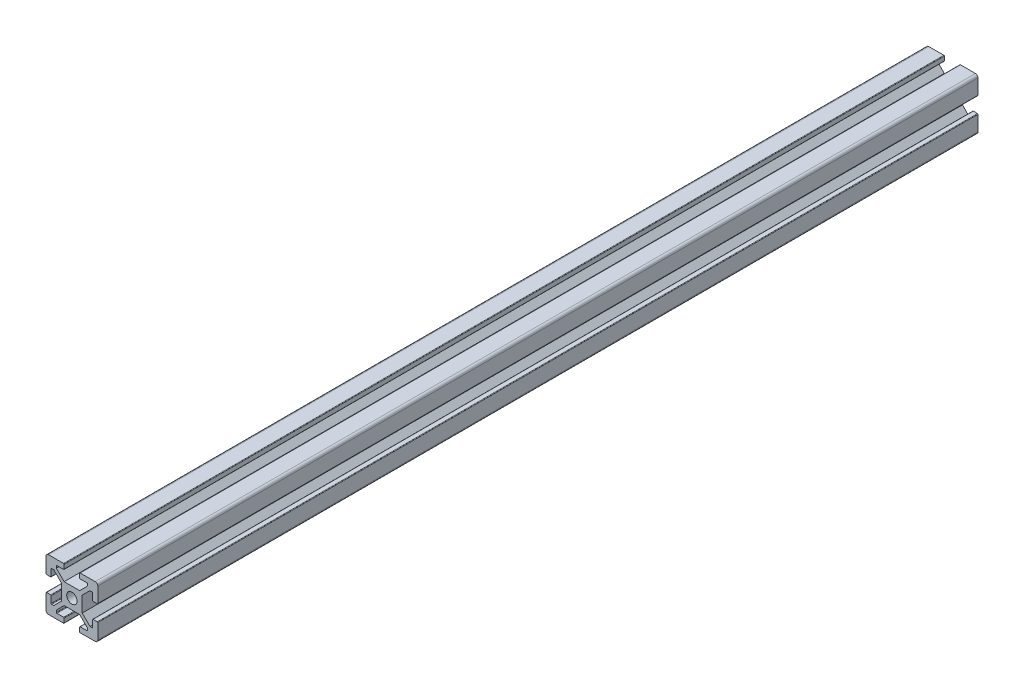
from build123d import *

# Parameters (mm, degrees)
SKETCH1_R           = 2
BOSS_EXTRUDE1_DEPTH = 340


with BuildPart() as part:
    # Sketch1 → Boss-Extrude1 (new body)
    with BuildSketch(Plane.XY):
        with BuildLine():
            Line((-3.2, 8), (-5.800532354, 8))
            ThreePointArc((-5.800532354, 8), (-5.941765118, 7.941609697), (-6.000531643, 7.800533062))
            Line((-6.000531643, 7.800533062), (-6.002658236, 7.002658236))
            Line((-6.002658236, 7.002658236), (-3, 4))
            Line((-3, 4), (3, 4))
            Line((3, 4), (6.002658236, 7.002658236))
            Line((6.002658236, 7.002658236), (6.000531643, 7.800533062))
            ThreePointArc((6.000531643, 7.800533062), (5.941765118, 7.941609697), (5.800532354, 8))
            Line((5.800532354, 8), (3.2, 8))
            ThreePointArc((3.2, 8), (3.058578644, 8.058578644), (3, 8.2))
            Line((3, 8.2), (3, 9.8))
            ThreePointArc((3, 9.8), (3.058578644, 9.941421356), (3.2, 10))
            Line((3.2, 10), (9, 10))
            ThreePointArc((9, 10), (9.707106781, 9.707106781), (10, 9))
            Line((10, 9), (10, 3.2))
            ThreePointArc((10, 3.2), (9.941421356, 3.058578644), (9.8, 3))
            Line((9.8, 3), (8.2, 3))
            ThreePointArc((8.2, 3), (8.058578644, 3.058578644), (8, 3.2))
            Line((8, 3.2), (8, 5.800532354))
            ThreePointArc((8, 5.800532354), (7.941609697, 5.941765118), (7.800533062, 6.000531643))
            Line((7.800533062, 6.000531643), (7.002658236, 6.002658236))
            Line((7.002658236, 6.002658236), (4, 3))
            Line((4, 3), (4, -3))
            Line((4, -3), (7.002658236, -6.002658236))
            Line((7.002658236, -6.002658236), (7.800533062, -6.000531643))
            ThreePointArc((7.800533062, -6.000531643), (7.941609697, -5.941765118), (8, -5.800532354))
            Line((8, -5.800532354), (8, -3.2))
            ThreePointArc((8, -3.2), (8.058578644, -3.058578644), (8.2, -3))
            Line((8.2, -3), (9.8, -3))
            ThreePointArc((9.8, -3), (9.941421356, -3.058578644), (10, -3.2))
            Line((10, -3.2), (10, -9))
            ThreePointArc((10, -9), (9.707106781, -9.707106781), (9, -10))
            Line((9, -10), (3.2, -10))
            ThreePointArc((3.2, -10), (3.058578644, -9.941421356), (3, -9.8))
            Line((3, -9.8), (3, -8.2))
            ThreePointArc((3, -8.2), (3.058578644, -8.058578644), (3.2, -8))
            Line((3.2, -8), (5.800532354, -8))
            ThreePointArc((5.800532354, -8), (5.941765118, -7.941609697), (6.000531643, -7.800533062))
            Line((6.000531643, -7.800533062), (6.002658236, -7.002658236))
            Line((6.002658236, -7.002658236), (3, -4))
            Line((3, -4), (-3, -4))
            Line((-3, -4), (-6.002658236, -7.002658236))
            Line((-6.002658236, -7.002658236), (-6.000531643, -7.800533062))
            ThreePointArc((-6.000531643, -7.800533062), (-5.941765118, -7.941609697), (-5.800532354, -8))
            Line((-5.800532354, -8), (-3.2, -8))
            ThreePointArc((-3.2, -8), (-3.058578644, -8.058578644), (-3, -8.2))
            Line((-3, -8.2), (-3, -9.8))
            ThreePointArc((-3, -9.8), (-3.058578644, -9.941421356), (-3.2, -10))
            Line((-3.2, -10), (-9, -10))
            ThreePointArc((-9, -10), (-9.707106781, -9.707106781), (-10, -9))
            Line((-10, -9), (-10, -3.2))
            ThreePointArc((-10, -3.2), (-9.941421356, -3.058578644), (-9.8, -3))
            Line((-9.8, -3), (-8.2, -3))
            ThreePointArc((-8.2, -3), (-8.058578644, -3.058578644), (-8, -3.2))
            Line((-8, -3.2), (-8, -5.800532354))
            ThreePointArc((-8, -5.800532354), (-7.941609697, -5.941765118), (-7.800533062, -6.000531643))
            Line((-7.800533062, -6.000531643), (-7.002658236, -6.002658236))
            Line((-7.002658236, -6.002658236), (-4, -3))
            Line((-4, -3), (-4, 3))
            Line((-4, 3), (-7.002658236, 6.002658236))
            Line((-7.002658236, 6.002658236), (-7.800533062, 6.000531643))
            ThreePointArc((-7.800533062, 6.000531643), (-7.941609697, 5.941765118), (-8, 5.800532354))
            Line((-8, 5.800532354), (-8, 3.2))
            ThreePointArc((-8, 3.2), (-8.058578644, 3.058578644), (-8.2, 3))
            Line((-8.2, 3), (-9.8, 3))
            ThreePointArc((-9.8, 3), (-9.941421356, 3.058578644), (-10, 3.2))
            Line((-10, 3.2), (-10, 9))
            ThreePointArc((-10, 9), (-9.707106781, 9.707106781), (-9, 10))
            Line((-9, 10), (-3.2, 10))
            ThreePointArc((-3.2, 10), (-3.058578644, 9.941421356), (-3, 9.8))
            Line((-3, 9.8), (-3, 8.2))
            ThreePointArc((-3, 8.2), (-3.058578644, 8.058578644), (-3.2, 8))
        make_face()
        Circle(SKETCH1_R, mode=Mode.SUBTRACT)
    extrude(amount=BOSS_EXTRUDE1_DEPTH)


solid = part.part
